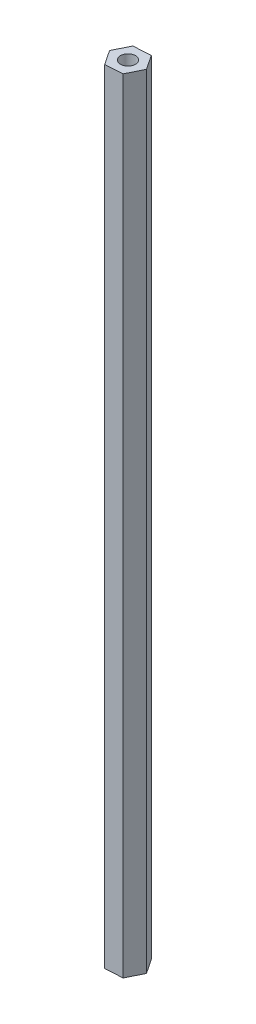
from build123d import *

# Parameters (mm, degrees)
SKETCH_1_R      = 1.5
EXTRUDE_1_DEPTH = 156


with BuildPart() as part:
    # 草图1 → 凸台-拉伸1 (new body)
    with BuildSketch(Plane(origin=(0, 0, 0), x_dir=(1, 0, 0), z_dir=(0, 1, 0))):
        Polygon((1.921537846, -2.882306768), (3.456919806, 0.222947204), (1.53538196, 3.105253973), (-1.921537846, 2.882306768), (-3.456919806, -0.222947204), (-1.53538196, -3.105253973), align=None)
        with Locations(Location((0, 0, 0), (0, 0, 270))):
            Circle(SKETCH_1_R, mode=Mode.SUBTRACT)
    extrude(amount=EXTRUDE_1_DEPTH)


solid = part.part
